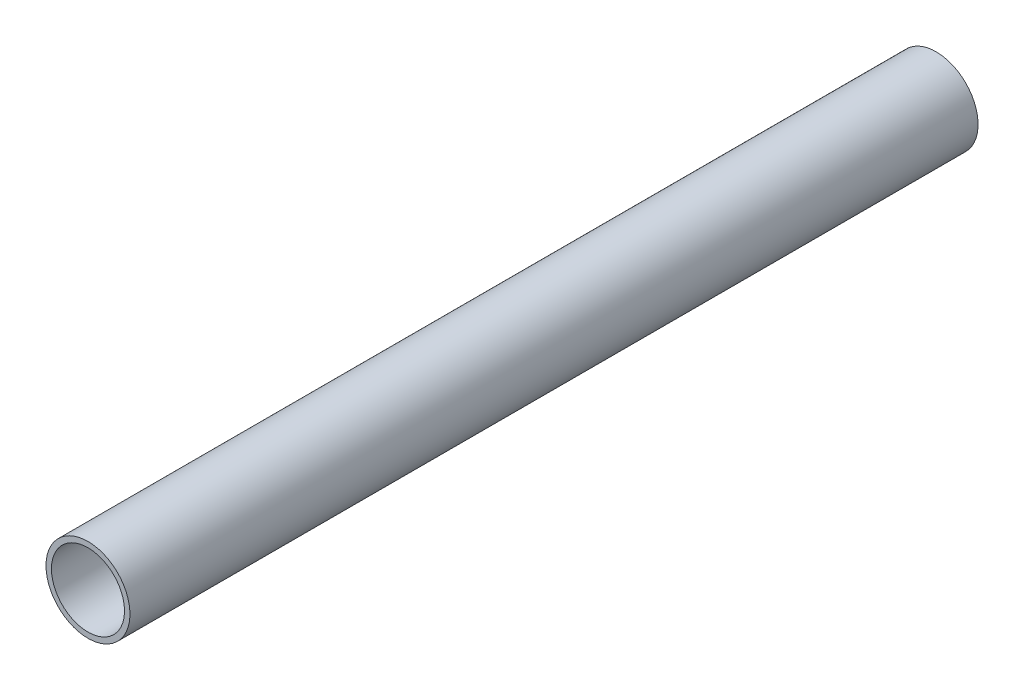
from build123d import *

# Parameters (mm, degrees)
SKETCH1_R           = 30.1625
SKETCH1_R_2         = 26.2509
BOSS_EXTRUDE1_DEPTH = 609.6


with BuildPart() as part:
    # Sketch1 → Boss-Extrude1 (new body)
    with BuildSketch(Plane.XY):
        with Locations(Location((0, 0, 0), (0, 0, 180))):
            Circle(SKETCH1_R)
        with Locations(Location((0, 0, 0), (0, 0, 180))):
            Circle(SKETCH1_R_2, mode=Mode.SUBTRACT)
    extrude(amount=BOSS_EXTRUDE1_DEPTH)


solid = part.part
